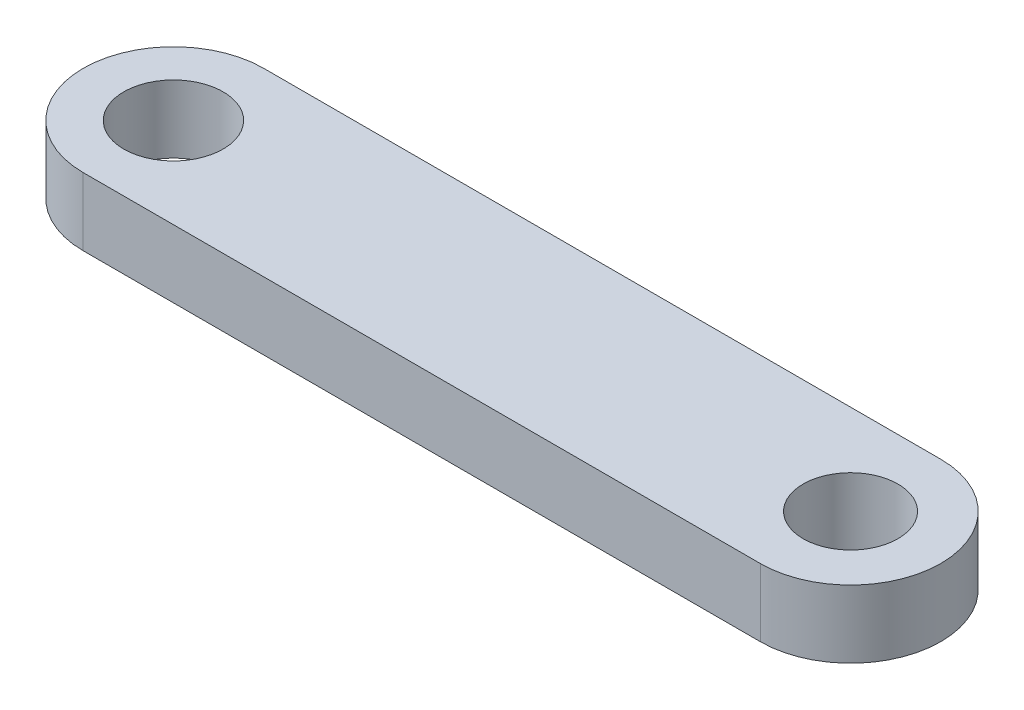
from build123d import *

# Parameters (mm, degrees)
SKETCH1_R           = 2.1
SKETCH1_R_2         = 2.2
BOSS_EXTRUDE1_DEPTH = 3


with BuildPart() as part:
    # Sketch1 → Boss-Extrude1 (new body)
    with BuildSketch(Plane(origin=(0, 0, 0), x_dir=(1, 0, 0), z_dir=(0, 1, 0))):
        with BuildLine():
            Line((-15, 4), (15, 4))
            ThreePointArc((15, 4), (19, 0), (15, -4))
            Line((15, -4), (-15, -4))
            ThreePointArc((-15, -4), (-19, 0), (-15, 4))
        make_face()
        with Locations(Location((15, 0, 0), (0, 0, 270))):
            Circle(SKETCH1_R, mode=Mode.SUBTRACT)
        with Locations(Location((-15, 0, 0), (0, 0, 270))):
            Circle(SKETCH1_R_2, mode=Mode.SUBTRACT)
    extrude(amount=BOSS_EXTRUDE1_DEPTH)


solid = part.part
